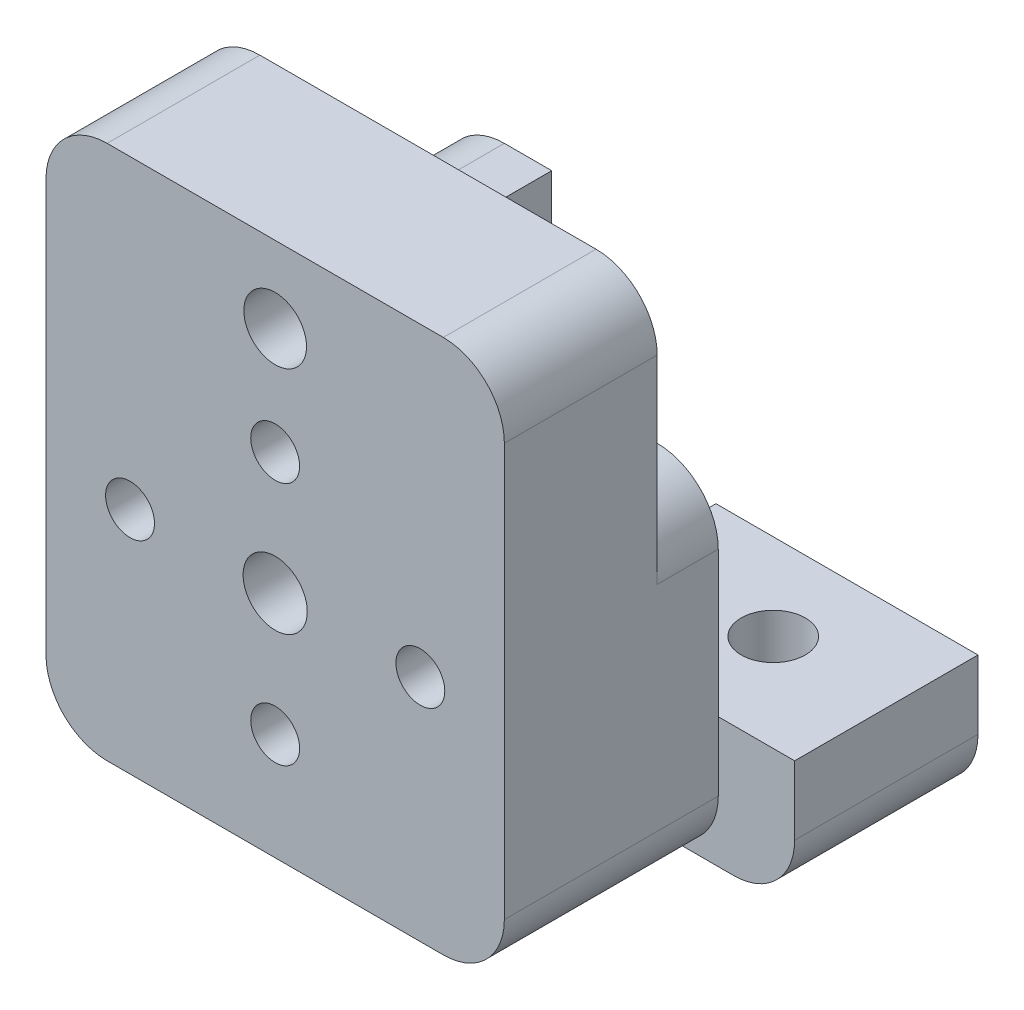
from build123d import *

# Parameters (mm, degrees)
SKETCH1_W           = 30
SKETCH1_H           = 35
SKETCH1_R           = 2.05
SKETCH1_R_2         = 2.1
SKETCH1_R_3         = 1.6
BOSS_EXTRUDE1_DEPTH = 10
SKETCH2_R           = 2.85
CUT_EXTRUDE1_DEPTH  = 5
FILLET1_R           = 4
BOSS_EXTRUDE2_START = -4
SKETCH6_R           = 2.85
BOSS_EXTRUDE2_DEPTH = 4
BOSS_EXTRUDE3_START = 12
BOSS_EXTRUDE3_DEPTH = 12
SKETCH8_R           = 2.1
CUT_EXTRUDE4_DEPTH  = 53.019227215


with BuildPart() as part:
    # Sketch1 → Boss-Extrude1 (new body)
    with BuildSketch(Plane.XY):
        with Locations((15, 17.5)):
            Rectangle(SKETCH1_W, SKETCH1_H)
        with Locations((15, 30)):
            Circle(SKETCH1_R, mode=Mode.SUBTRACT)
        with Locations((15, 15)):
            Circle(SKETCH1_R_2, mode=Mode.SUBTRACT)
        with Locations((5.5, 15)):
            Circle(SKETCH1_R_3, mode=Mode.SUBTRACT)
        with Locations((24.5, 15)):
            Circle(SKETCH1_R_3, mode=Mode.SUBTRACT)
        with Locations((15, 7)):
            Circle(SKETCH1_R_3, mode=Mode.SUBTRACT)
        with Locations((15, 23)):
            Circle(SKETCH1_R_3, mode=Mode.SUBTRACT)
    extrude(amount=BOSS_EXTRUDE1_DEPTH)

    # Sketch2 → Cut-Extrude1 (cut)
    with BuildSketch(Plane(origin=(0, 0, 0), x_dir=(-1, 0, 0), z_dir=(0, 0, -1))):
        with Locations((-15, 7)):
            Circle(SKETCH2_R)
        with Locations((-24.5, 15)):
            Circle(SKETCH2_R)
        with Locations((-15, 23)):
            Circle(SKETCH2_R)
        with Locations((-5.5, 15)):
            Circle(SKETCH2_R)
    extrude(amount=-CUT_EXTRUDE1_DEPTH, mode=Mode.SUBTRACT)

    # Fillet1
    fillet1_edges = [part.edges().sort_by_distance(p)[0] for p in [
        (0, 35, 5),
        (30, 35, 5),
        (30, 0, 5),
        (0, 0, 5),
    ]]
    fillet(fillet1_edges, radius=FILLET1_R)

    # Sketch6 → Boss-Extrude2 (add)
    with BuildSketch(Plane.XY.offset(BOSS_EXTRUDE2_START)):
        with BuildLine():
            Line((26, 22), (17.668801229, 22))
            ThreePointArc((17.668801229, 22), (15, 20.15), (12.331198771, 22))
            Line((12.331198771, 22), (4, 22))
            ThreePointArc((4, 22), (1.171572875, 20.828427125), (0, 18))
            Line((0, 18), (0, 4))
            ThreePointArc((0, 4), (1.171572875, 1.171572875), (4, 0))
            Line((4, 0), (26, 0))
            ThreePointArc((26, 0), (28.828427125, 1.171572875), (30, 4))
            Line((30, 4), (30, 18))
            ThreePointArc((30, 18), (28.828427125, 20.828427125), (26, 22))
        make_face()
        with Locations((5.5, 15)):
            Circle(SKETCH6_R, mode=Mode.SUBTRACT)
        with Locations((15, 7)):
            Circle(SKETCH6_R, mode=Mode.SUBTRACT)
        with Locations((24.5, 15)):
            Circle(SKETCH6_R, mode=Mode.SUBTRACT)
    extrude(amount=BOSS_EXTRUDE2_DEPTH)

    # Sketch7 → Boss-Extrude3 (add)
    with BuildSketch(Plane(origin=(0, 0, -4), x_dir=(-1, 0, 0), z_dir=(0, 0, -1)).offset(BOSS_EXTRUDE3_START)):
        with BuildLine():
            Line((-7.1, 22), (-7.1, 17.85))
            Line((-7.1, 17.85), (-5.5, 17.85))
            ThreePointArc((-5.5, 17.85), (-2.65, 15), (-5.5, 12.15))
            Line((-5.5, 12.15), (-7.1, 12.15))
            Line((-7.1, 12.15), (-7.1, 8.5))
            Line((-7.1, 8.5), (-12.15, 8.5))
            Line((-12.15, 8.5), (-12.15, 7))
            ThreePointArc((-12.15, 7), (-15, 4.15), (-17.85, 7))
            Line((-17.85, 7), (-17.85, 8.5))
            Line((-17.85, 8.5), (-30, 8.5))
            Line((-30, 8.5), (-35, 8.5))
            Line((-35, 8.5), (-35, 4))
            ThreePointArc((-35, 4), (-33.828427125, 1.171572875), (-31, 0))
            Line((-31, 0), (-26, 0))
            Line((-26, 0), (-4, 0))
            ThreePointArc((-4, 0), (-1.171572875, 1.171572875), (0, 4))
            Line((0, 4), (0, 18))
            ThreePointArc((0, 18), (-1.171572875, 20.828427125), (-4, 22))
            Line((-4, 22), (-7.1, 22))
        make_face()
    extrude(amount=-BOSS_EXTRUDE3_DEPTH)

    # Sketch8 → Cut-Extrude4 (cut, through all)
    with BuildSketch(Plane.XZ):
        with Locations((12.249401243, -10.35)):
            Circle(SKETCH8_R)
        with Locations((27.249401243, -10.35)):
            Circle(SKETCH8_R)
    extrude(amount=-CUT_EXTRUDE4_DEPTH, mode=Mode.SUBTRACT)


solid = part.part
